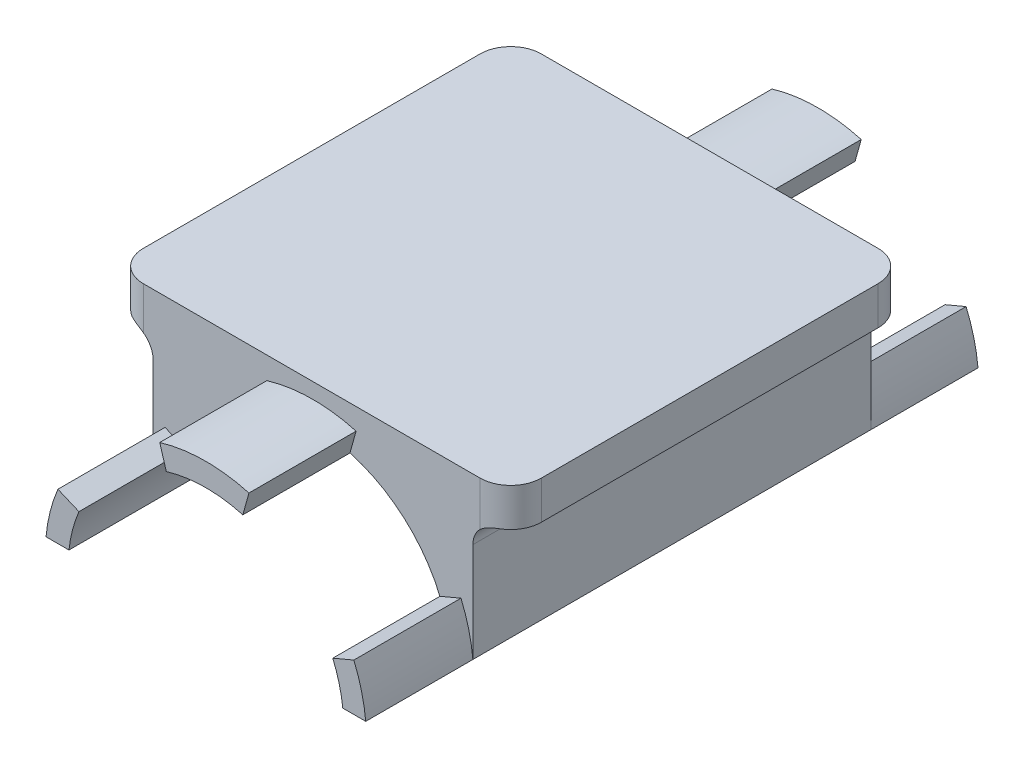
from build123d import *

# Parameters (mm, degrees)
SKETCH1_W                       = 26
SKETCH1_H                       = 26
BOSS_EXTRUDE1_DEPTH             = 2.5
BOSS_EXTRUDE2_REACH             = 20.554
BOSS_EXTRUDE2_DIRECTION_2_REACH = 20.554
BOSS_EXTRUDE3_DEPTH             = 20
BOSS_EXTRUDE3_DEPTH_BACK        = 20
FILLET1_R                       = 2
FILLET2_R                       = 1.5


with BuildPart() as part:
    # Sketch1 → Boss-Extrude1 (new body)
    with BuildSketch(Plane(origin=(0, 0, 0), x_dir=(1, 0, 0), z_dir=(0, 1, 0))):
        Rectangle(SKETCH1_W, SKETCH1_H)
    extrude(amount=BOSS_EXTRUDE1_DEPTH)

    # Boss-Extrude2: up to this face of the body (flat: up to its plane)
    boss_extrude2_end = Plane(part.part.faces().sort_by_distance((0, 1.25, 13))[0])
    # Sketch2 → Boss-Extrude2 (add, up to the picked face)
    with BuildSketch(Plane.XY, mode=Mode.PRIVATE) as boss_extrude2_sk1:
        with BuildLine():
            Line((10.529394514, -8), (10.529394514, 0))
            Line((10.529394514, 0), (0.170155306, 0))
            ThreePointArc((0.170155306, 0), (6.116867713, -2.319963995), (9.029394514, -8))
            Line((9.029394514, -8), (10.529394514, -8))
        make_face()
    boss_extrude2_tool1 = split(extrude(boss_extrude2_sk1.sketch, amount=BOSS_EXTRUDE2_REACH, mode=Mode.PRIVATE), bisect_by=boss_extrude2_end, keep=Keep.BOTH, mode=Mode.PRIVATE)
    # Sketch2 → Boss-Extrude2 (add, up to the picked face)
    with BuildSketch(Plane.XY, mode=Mode.PRIVATE) as boss_extrude2_sk2:
        with BuildLine():
            ThreePointArc((-8.859239207, -8), (-5.946712406, -2.319963995), (0, 0))
            Line((0, 0), (-10.359239207, 0))
            Line((-10.359239207, 0), (-10.359239207, -8))
            Line((-10.359239207, -8), (-8.859239207, -8))
        make_face()
    boss_extrude2_tool2 = split(extrude(boss_extrude2_sk2.sketch, amount=BOSS_EXTRUDE2_REACH, mode=Mode.PRIVATE), bisect_by=boss_extrude2_end, keep=Keep.BOTH, mode=Mode.PRIVATE)
    add(boss_extrude2_tool1.solids().sort_by(Axis((8.165693, -2.801403, 0), (0, 0, 1)))[0])
    add(boss_extrude2_tool2.solids().sort_by(Axis((-7.995538, -2.801403, 0), (0, 0, 1)))[0])

    # Boss-Extrude2 direction 2: up to this face of the body (flat: up to its plane)
    boss_extrude2_direction_2_end = Plane(part.part.faces().sort_by_distance((0, 1.25, -13))[0])
    # Sketch2 → Boss-Extrude2 direction 2 (add, up to the picked face)
    with BuildSketch(Plane.XY, mode=Mode.PRIVATE) as boss_extrude2_direction_2_sk1:
        with BuildLine():
            Line((10.529394514, -8), (10.529394514, 0))
            Line((10.529394514, 0), (0.170155306, 0))
            ThreePointArc((0.170155306, 0), (6.116867713, -2.319963995), (9.029394514, -8))
            Line((9.029394514, -8), (10.529394514, -8))
        make_face()
    boss_extrude2_direction_2_tool1 = split(extrude(boss_extrude2_direction_2_sk1.sketch, amount=-BOSS_EXTRUDE2_DIRECTION_2_REACH, mode=Mode.PRIVATE), bisect_by=boss_extrude2_direction_2_end, keep=Keep.BOTH, mode=Mode.PRIVATE)
    # Sketch2 → Boss-Extrude2 direction 2 (add, up to the picked face)
    with BuildSketch(Plane.XY, mode=Mode.PRIVATE) as boss_extrude2_direction_2_sk2:
        with BuildLine():
            ThreePointArc((-8.859239207, -8), (-5.946712406, -2.319963995), (0, 0))
            Line((0, 0), (-10.359239207, 0))
            Line((-10.359239207, 0), (-10.359239207, -8))
            Line((-10.359239207, -8), (-8.859239207, -8))
        make_face()
    boss_extrude2_direction_2_tool2 = split(extrude(boss_extrude2_direction_2_sk2.sketch, amount=-BOSS_EXTRUDE2_DIRECTION_2_REACH, mode=Mode.PRIVATE), bisect_by=boss_extrude2_direction_2_end, keep=Keep.BOTH, mode=Mode.PRIVATE)
    add(boss_extrude2_direction_2_tool1.solids().sort_by(Axis((8.165693, -2.801403, 0), (0, 0, -1)))[0])
    add(boss_extrude2_direction_2_tool2.solids().sort_by(Axis((-7.995538, -2.801403, 0), (0, 0, -1)))[0])

    # Sketch3 → Boss-Extrude3 (add, two sides: drawn at the far end of the back side and taken through both)
    with BuildSketch(Plane.XY.offset(-BOSS_EXTRUDE3_DEPTH_BACK)):
        with BuildLine():
            ThreePointArc((-8.859239207, -8), (-8.623127821, -6.726459638), (-8.206654057, -5.5))
            Line((-8.206654057, -5.5), (-9.58127784, -4.919828013))
            ThreePointArc((-9.58127784, -4.919828013), (-10.087515452, -6.430298336), (-10.359239207, -8))
            Line((-10.359239207, -8), (-8.859239207, -8))
        make_face()
        with BuildLine():
            Line((9.751433146, -4.919828013), (8.376809364, -5.5))
            ThreePointArc((8.376809364, -5.5), (8.793283128, -6.726459638), (9.029394514, -8))
            Line((9.029394514, -8), (10.529394514, -8))
            ThreePointArc((10.529394514, -8), (10.257670759, -6.430298336), (9.751433146, -4.919828013))
        make_face()
        with BuildLine():
            ThreePointArc((-2.5, -0.378845376), (-0.003485724, -3.3627e-05), (2.5, -0.329641118))
            Line((2.5, -0.329641118), (2.900351797, 1.107685747))
            ThreePointArc((2.900351797, 1.107685747), (-0.01816798, 1.491936382), (-2.928560564, 1.050324284))
            Line((-2.928560564, 1.050324284), (-2.5, -0.378845376))
        make_face()
    extrude(amount=BOSS_EXTRUDE3_DEPTH + BOSS_EXTRUDE3_DEPTH_BACK)

    # Fillet1
    fillet1_edges = [part.edges().sort_by_distance(p)[0] for p in [
        (13, 1.25, 13),
        (-13, 1.25, 13),
        (-13, 1.25, -13),
        (13, 1.25, -13),
    ]]
    fillet(fillet1_edges, radius=FILLET1_R)

    # Fillet2
    fillet2_edges = [part.edges().sort_by_distance(p)[0] for p in [
        (-10.359239207, 0, 0),
        (10.529394514, 0, 0),
    ]]
    fillet(fillet2_edges, radius=FILLET2_R)


solid = part.part
